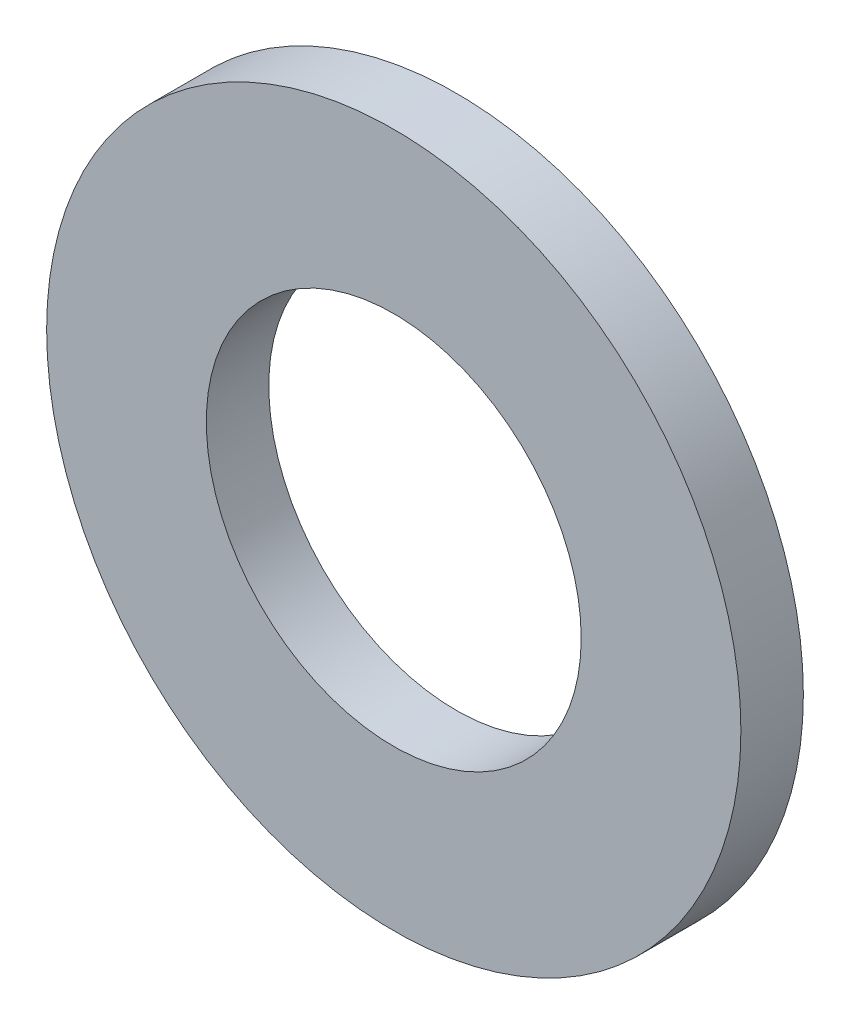
from build123d import *

# Parameters (mm, degrees)
ESBO_O1_R                = 5
ESBO_O1_R_2              = 2.7
RESSALTO_EXTRUS_O1_DEPTH = 0.9


with BuildPart() as part:
    # Esboço1 → Ressalto-extrusão1 (new body)
    with BuildSketch(Plane.XY):
        Circle(ESBO_O1_R)
        Circle(ESBO_O1_R_2, mode=Mode.SUBTRACT)
    extrude(amount=RESSALTO_EXTRUS_O1_DEPTH)


solid = part.part
